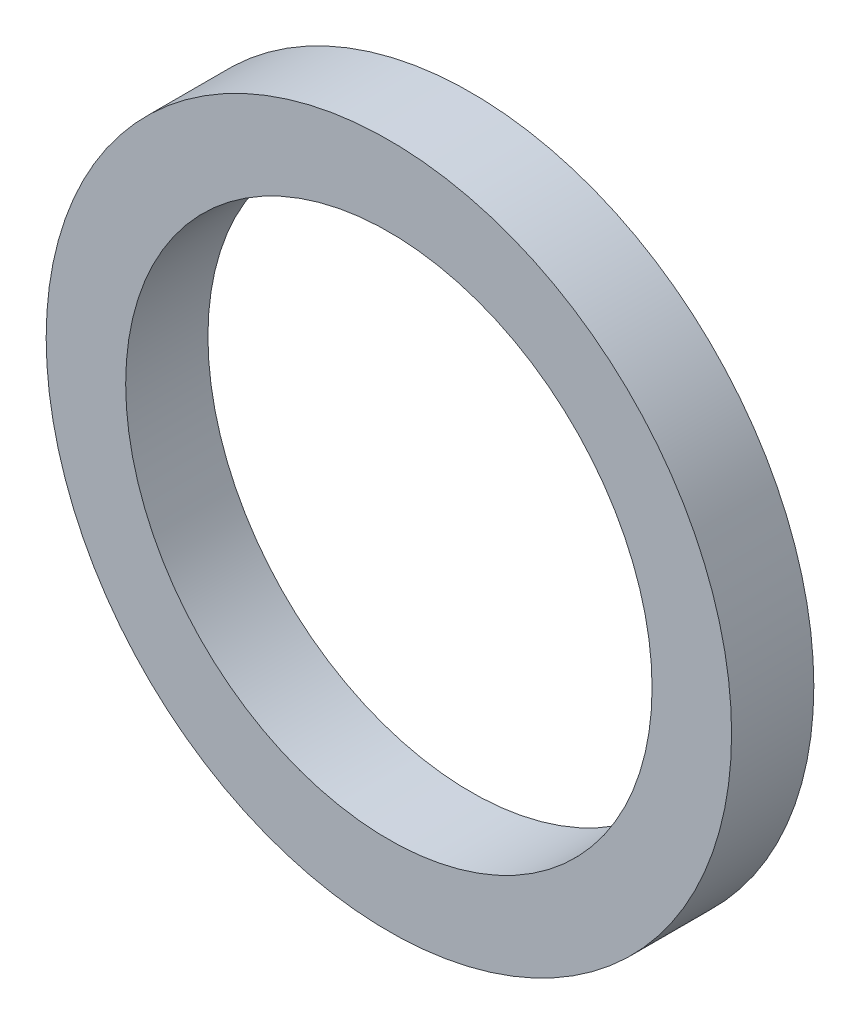
from build123d import *

# Parameters (mm, degrees)
SKETCH1_R           = 31.75
BOSS_EXTRUDE1_DEPTH = 7.62
SKETCH3_R           = 24.384
CUT_EXTRUDE1_DEPTH  = 7.62


with BuildPart() as part:
    # Sketch1 → Boss-Extrude1 (new body)
    with BuildSketch(Plane.XY):
        with Locations(Location((0, 0, 0), (0, 0, 180))):
            Circle(SKETCH1_R)
    extrude(amount=BOSS_EXTRUDE1_DEPTH)

    # Sketch3 → Cut-Extrude1 (cut)
    with BuildSketch(Plane.XY.offset(7.62)):
        Circle(SKETCH3_R)
    extrude(amount=-CUT_EXTRUDE1_DEPTH, mode=Mode.SUBTRACT)


solid = part.part
